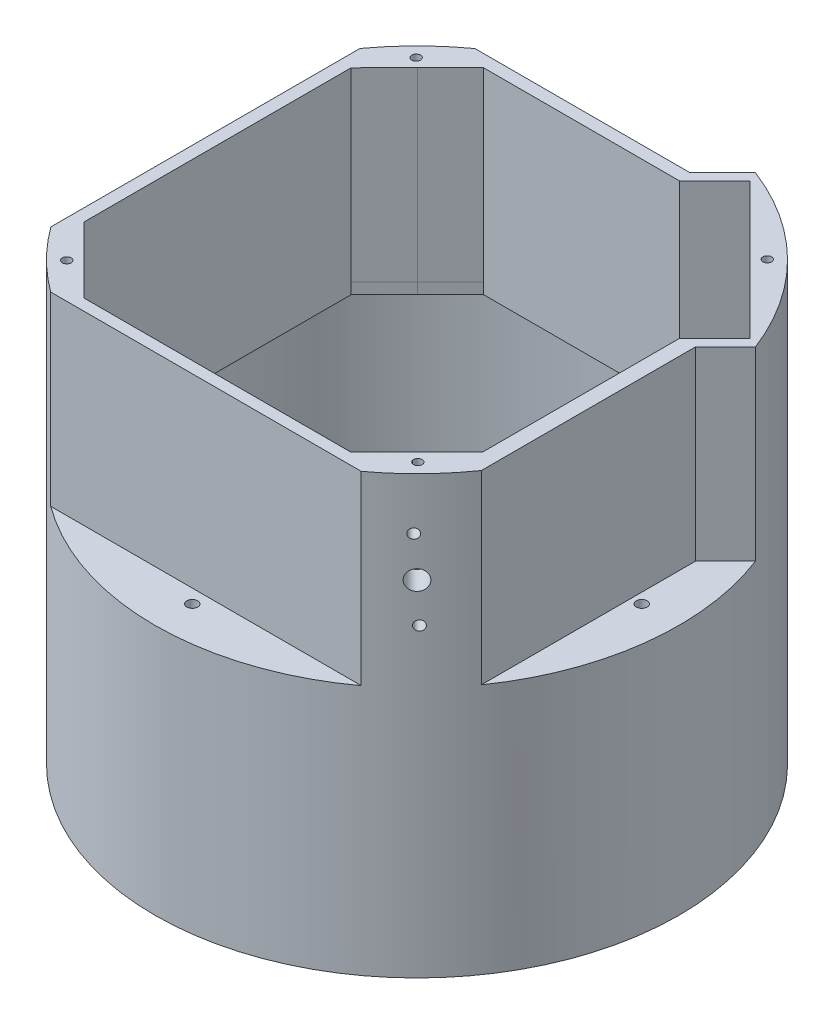
from build123d import *

# Parameters (mm, degrees)
CROQUIS1_R              = 120
CROQUIS1_R_2            = 115
SALIENTE_EXTRUIR1_DEPTH = 110
CROQUIS2_R              = 120
CROQUIS2_W              = 152.253442708
CROQUIS2_H              = 152.577386202
SALIENTE_EXTRUIR2_DEPTH = 90
CORTAR_EXTRUIR1_START   = -85
CORTAR_EXTRUIR1_DEPTH   = 85
CORTAR_EXTRUIR2_DEPTH   = 30
CROQUIS5_R              = 2
CORTAR_EXTRUIR3_DEPTH   = 10
CROQUIS7_R              = 4.5
CORTAR_EXTRUIR4_DEPTH   = 343.045214483
CROQUIS8_R              = 2.25
CORTAR_EXTRUIR5_DEPTH   = 30
CROQUIS12_R             = 2.5
CORTAR_EXTRUIR7_DEPTH   = 15


with BuildPart() as part:
    # Croquis1 → Saliente-Extruir1 (new body)
    with BuildSketch(Plane(origin=(0, 0, 0), x_dir=(1, 0, 0), z_dir=(0, 1, 0))):
        with Locations(Location((0, 0, 0), (0, 0, 270))):
            Circle(CROQUIS1_R)
        with Locations(Location((0, 0, 0), (0, 0, 270))):
            Circle(CROQUIS1_R_2, mode=Mode.SUBTRACT)
    extrude(amount=SALIENTE_EXTRUIR1_DEPTH)

    # Croquis2 → Saliente-Extruir2 (add)
    with BuildSketch(Plane(origin=(0, 110, 0), x_dir=(1, 0, 0), z_dir=(0, 1, 0))):
        with Locations(Location((0, 0, 0), (0, 0, 270))):
            Circle(CROQUIS2_R)
        Rectangle(CROQUIS2_W, CROQUIS2_H, mode=Mode.SUBTRACT)
    extrude(amount=SALIENTE_EXTRUIR2_DEPTH)

    # Croquis3 → Cortar-Extruir1 (cut)
    with BuildSketch(Plane(origin=(0, 200, 0), x_dir=(1, 0, 0), z_dir=(0, 1, 0)).offset(CORTAR_EXTRUIR1_START)):
        Polygon((-45.841188947, 76.288693101), (43.949902098, 76.288693101), (28.807150506, 91.431444693), (-61.004991492, 91.431444693), align=None)
        Polygon((-91.267423391, -61.169009949), (-76.126721354, -46.007259807), (-76.126721354, 45.961058747), (-91.267423391, 61.101790004), align=None)
        Polygon((-61.028027907, -91.408376254), (61.007038201, -91.408376254), (45.887355048, -76.288693101), (-45.887325869, -76.288693101), align=None)
        Polygon((76.126721354, -46.007289027), (91.267423391, -61.147991064), (91.267423391, 28.971171808), (76.126721354, 44.111873845), align=None)
        with BuildLine():
            Line((98.300064852, 29.330876538), (98.300064852, -68.82657372))
            ThreePointArc((98.300064852, -68.82657372), (114.446511048, -36.083183186), (120, 0))
            ThreePointArc((120, 0), (119.08657738, 14.777925699), (116.360215201, 29.330876538))
            Line((116.360215201, 29.330876538), (98.300064852, 29.330876538))
        make_face()
        with BuildLine():
            Line((71.118639022, -96.654742169), (-71.118639022, -96.654742169))
            ThreePointArc((-71.118639022, -96.654742169), (0, -120), (71.118639022, -96.654742169))
        make_face()
        with BuildLine():
            Line((-96.908612184, -70.772317219), (-96.908612184, 70.772317219))
            ThreePointArc((-96.908612184, 70.772317219), (-120, 0), (-96.908612184, -70.772317219))
        make_face()
        with BuildLine():
            ThreePointArc((27.732572497, 116.751464328), (-23.555261835, 117.665413949), (-70.538900009, 97.078646393))
            Line((-70.538900009, 97.078646393), (27.732572497, 97.078646393))
            Line((27.732572497, 97.078646393), (27.732572497, 116.751464328))
        make_face()
        Polygon((76.126721354, 44.111873845), (91.267423391, 28.971171808), (107.376851904, 45.080600321), (91.267423391, 61.190028833), (61.007038201, 91.408376254), (44.895560134, 107.519854321), (28.807150506, 91.431444693), (43.949902098, 76.288693101), (76.126721354, 76.288693101), align=None)
        Polygon((61.007038201, -91.408376254), (76.126721354, -76.288693101), (45.887355048, -76.288693101), align=None)
        Polygon((76.126721354, -46.007289027), (76.126721354, -76.288693101), (91.267423391, -61.147991064), align=None)
        Polygon((-91.267423391, -61.169009949), (-76.126721354, -76.288693101), (-76.126721354, -46.007259807), align=None)
        Polygon((-76.126721354, -76.288693101), (-61.028027907, -91.408376254), (-45.887325869, -76.288693101), align=None)
        Polygon((-91.267423391, 61.101790004), (-76.126721354, 45.961058747), (-76.126721354, 76.288693101), align=None)
        Polygon((-76.126721354, 76.288693101), (-45.841188947, 76.288693101), (-61.004991492, 91.431444693), align=None)
        with BuildLine():
            Line((27.732572497, 116.751464328), (27.732572497, 97.078646393))
            Line((27.732572497, 97.078646393), (42.772301896, 112.118375793))
            ThreePointArc((42.772301896, 112.118375793), (35.32846877, 114.68173043), (27.732572497, 116.751464328))
        make_face()
        with BuildLine():
            ThreePointArc((116.360215201, 29.330876538), (114.392817368, 36.253045866), (112.014025768, 43.044837453))
            Line((112.014025768, 43.044837453), (98.300064852, 29.330876538))
            Line((98.300064852, 29.330876538), (116.360215201, 29.330876538))
        make_face()
    extrude(amount=CORTAR_EXTRUIR1_DEPTH, mode=Mode.SUBTRACT)

    # Croquis4 → Cortar-Extruir2 (cut)
    with BuildSketch(Plane(origin=(0, 115, 0), x_dir=(1, 0, 0), z_dir=(0, 1, 0))):
        Polygon((-91.267423391, 61.101790004), (-91.267423391, -61.169009949), (-61.028027907, -91.408376254), (61.007038201, -91.408376254), (91.267423391, -61.147991064), (91.267423391, 28.971171808), (107.376851904, 45.080600321), (44.895560134, 107.519854321), (28.807150506, 91.431444693), (-61.004991492, 91.431444693), align=None)
    extrude(amount=-CORTAR_EXTRUIR2_DEPTH, mode=Mode.SUBTRACT)

    # Croquis5 → Cortar-Extruir3 (cut)
    with BuildSketch(Plane(origin=(0, 200, 0), x_dir=(1, 0, 0), z_dir=(0, 1, 0))):
        with Locations(Location((80.009543849, 80.403081156, 0), (0, 0, 270))):
            Circle(CROQUIS5_R)
        with Locations(Location((-80.403081156, 80.009543849, 0), (0, 0, 270))):
            Circle(CROQUIS5_R)
        with Locations(Location((-80.009543849, -80.403081156, 0), (0, 0, 270))):
            Circle(CROQUIS5_R)
        with Locations(Location((80.403081156, -80.009543849, 0), (0, 0, 270))):
            Circle(CROQUIS5_R)
    extrude(amount=-CORTAR_EXTRUIR3_DEPTH, mode=Mode.SUBTRACT)

    # Croquis7 → Cortar-Extruir4 (cut, through all)
    with BuildSketch(Plane(origin=(76.207707227, 0, 76.207707227), x_dir=(-0.7071067811865415, 0, 0.7071067811865537), z_dir=(-0.7071067811865537, 0, -0.7071067811865415))):
        with Locations((0, 157.851936769)):
            Circle(CROQUIS7_R)
    extrude(amount=-CORTAR_EXTRUIR4_DEPTH, mode=Mode.SUBTRACT)

    # Croquis8 → Cortar-Extruir5 (cut)
    with BuildSketch(Plane(origin=(76.207707227, 0, 76.207707227), x_dir=(-0.7071067811865415, 0, 0.7071067811865537), z_dir=(-0.7071067811865537, 0, -0.7071067811865415))):
        with Locations((1.055799094, 176.265297527)):
            Circle(CROQUIS8_R)
        with Locations((-0.790662854, 139.817237098)):
            Circle(CROQUIS8_R)
    extrude(amount=-CORTAR_EXTRUIR5_DEPTH, mode=Mode.SUBTRACT)

    # Croquis12 → Cortar-Extruir7 (cut)
    with BuildSketch(Plane(origin=(0, 115, 0), x_dir=(1, 0, 0), z_dir=(0, 1, 0))):
        with Locations(Location((102.928666222, 0, 0), (0, 0, 270))):
            Circle(CROQUIS12_R)
        with Locations(Location((0, -102.928666222, 0), (0, 0, 270))):
            Circle(CROQUIS12_R)
        with Locations(Location((-102.928666222, 0, 0), (0, 0, 270))):
            Circle(CROQUIS12_R)
        with Locations(Location((0, 102.928666222, 0), (0, 0, 270))):
            Circle(CROQUIS12_R)
    extrude(amount=-CORTAR_EXTRUIR7_DEPTH, mode=Mode.SUBTRACT)


solid = part.part
